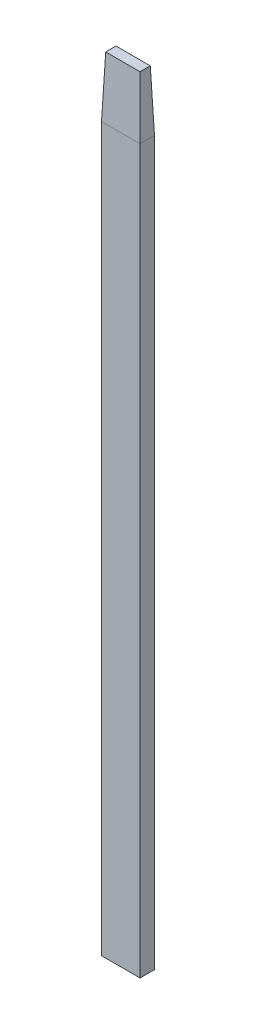
from build123d import *

# Parameters (mm, degrees)
ESQUISSE1_W        = 9.6
ESQUISSE1_H        = 180
BOSS_EXTRU_1_DEPTH = 1.8
ESQUISSE4_W        = 9.6
ESQUISSE4_H        = 3.6
BOSS_EXTRU_4_DEPTH = 15
D_POUILLE5_ANGLE   = -2


with BuildPart() as part:
    # Esquisse1 → Boss.-Extru.1 (new, symmetric)
    with BuildSketch(Plane.XY):
        Rectangle(ESQUISSE1_W, ESQUISSE1_H)
    extrude(amount=BOSS_EXTRU_1_DEPTH, both=True)


with BuildPart() as body_2:
    # Esquisse4 → Boss.-Extru.4 (new body)
    with BuildSketch(Plane(origin=(0, 90, 0), x_dir=(1, 0, 0), z_dir=(0, 1, 0))):
        Rectangle(ESQUISSE4_W, ESQUISSE4_H)
    extrude(amount=BOSS_EXTRU_4_DEPTH)

    # Dépouille5
    d_pouille5_faces = [body_2.faces().sort_by_distance(p)[0] for p in [
        (4.8, 97.5, 0),
        (0, 97.5, 1.8),
        (-4.8, 97.5, 0),
        (0, 97.5, -1.8),
    ]]
    draft(d_pouille5_faces, Plane(origin=(0, 90, 0), x_dir=(0, 0, -1), z_dir=(0, -1, 0)), D_POUILLE5_ANGLE)


solid = Compound([part.part, body_2.part])
